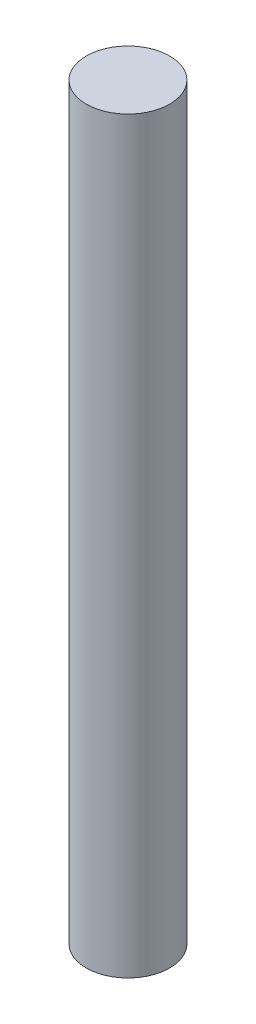
from build123d import *

# Parameters (mm, degrees)
BOSS_EXTRUDE1_DEPTH      = 100
BOSS_EXTRUDE1_DEPTH_BACK = 370
SKETCH2_R                = 26.2


with BuildPart() as part:
    # Sketch2 → Boss-Extrude1 (new, two sides: drawn at the far end of the back side and taken through both)
    with BuildSketch(Plane(origin=(0, 0, 0), x_dir=(1, 0, 0), z_dir=(0, 1, 0)).offset(-BOSS_EXTRUDE1_DEPTH_BACK)):
        with Locations(Location((0, 0, 0), (0, 0, 270))):
            Circle(SKETCH2_R)
    extrude(amount=BOSS_EXTRUDE1_DEPTH + BOSS_EXTRUDE1_DEPTH_BACK)


solid = part.part
